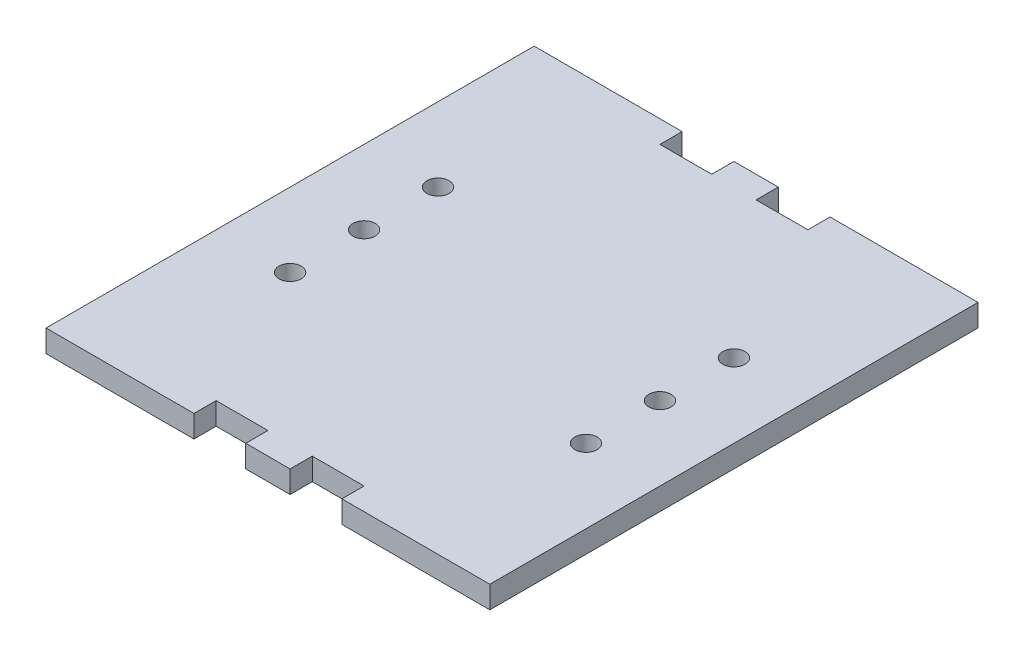
from build123d import *

# Parameters (mm, degrees)
SKETCH_1_R          = 1.5
EXTRUDE_1_DEPTH     = 3
SKETCH_2_W          = 20
SKETCH_2_H          = 3
SKETCH_2_W_2        = 7
SKETCH_2_W_3        = 6
CUT_EXTRUDE_1_DEPTH = 3


with BuildPart() as part:
    # 草图1 → 凸台-拉伸1 (new body)
    with BuildSketch(Plane(origin=(0, 0, 0), x_dir=(1, 0, 0), z_dir=(0, 1, 0))):
        Polygon((-3, 36), (3, 36), (3, 33), (10, 33), (10, 36), (30, 36), (30, -36), (10, -36), (10, -33), (3, -33), (3, -36), (-3, -36), (-3, -33), (-10, -33), (-10, -36), (-30, -36), (-30, 36), (-10, 36), (-10, 33), (-3, 33), align=None)
        with Locations(Location((-20, 0, 0), (0, 0, 270))):
            Circle(SKETCH_1_R, mode=Mode.SUBTRACT)
        with Locations(Location((-20, 10, 0), (0, 0, 270))):
            Circle(SKETCH_1_R, mode=Mode.SUBTRACT)
        with Locations(Location((-20, -10, 0), (0, 0, 270))):
            Circle(SKETCH_1_R, mode=Mode.SUBTRACT)
        with Locations(Location((20, -10, 0), (0, 0, 90))):
            Circle(SKETCH_1_R, mode=Mode.SUBTRACT)
        with Locations(Location((20, 0, 0), (0, 0, 90))):
            Circle(SKETCH_1_R, mode=Mode.SUBTRACT)
        with Locations(Location((20, 10, 0), (0, 0, 90))):
            Circle(SKETCH_1_R, mode=Mode.SUBTRACT)
    extrude(amount=EXTRUDE_1_DEPTH)

    # 草图2 → 切除-拉伸1 (cut)
    with BuildSketch(Plane(origin=(0, 3, 0), x_dir=(1, 0, 0), z_dir=(0, 1, 0))):
        Polygon((10, -36), (10, -33), (3, -33), (3, -36), (-3, -36), (-3, -33), (-10, -33), (-10, -36), (-30, -36), (-30, -51.145267559), (30, -51.145267559), (30, -36), align=None)
        with Locations((20, -34.5)):
            Rectangle(SKETCH_2_W, SKETCH_2_H)
        with Locations((6.5, -31.5)):
            Rectangle(SKETCH_2_W_2, SKETCH_2_H)
        with Locations((0, -34.5)):
            Rectangle(SKETCH_2_W_3, SKETCH_2_H)
        with Locations((-6.5, -31.5)):
            Rectangle(SKETCH_2_W_2, SKETCH_2_H)
        with Locations((-20, -34.5)):
            Rectangle(SKETCH_2_W, SKETCH_2_H)
        with Locations((-20, 34.5)):
            Rectangle(SKETCH_2_W, SKETCH_2_H)
        with Locations((-6.5, 31.5)):
            Rectangle(SKETCH_2_W_2, SKETCH_2_H)
        with Locations((0, 34.5)):
            Rectangle(SKETCH_2_W_3, SKETCH_2_H)
        with Locations((6.5, 31.5)):
            Rectangle(SKETCH_2_W_2, SKETCH_2_H)
        with Locations((20, 34.5)):
            Rectangle(SKETCH_2_W, SKETCH_2_H)
    extrude(amount=-CUT_EXTRUDE_1_DEPTH, mode=Mode.SUBTRACT)


solid = part.part
